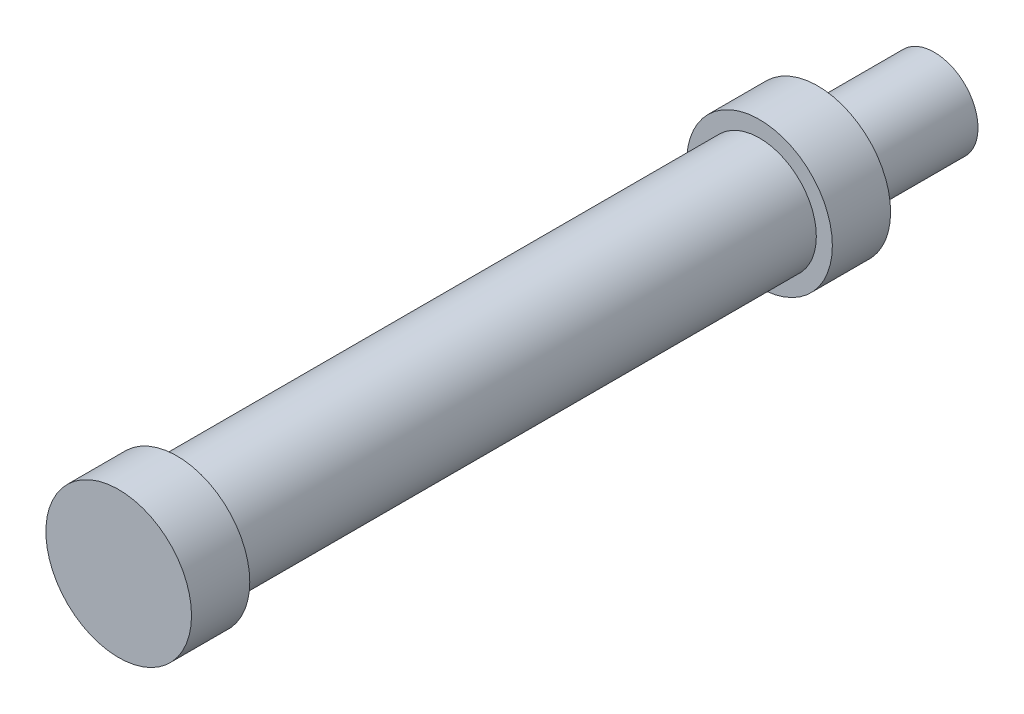
from build123d import *

# Parameters (mm, degrees)
SKETCH1_R           = 1.5
BOSS_EXTRUDE1_DEPTH = 4
SKETCH2_R           = 2.5
BOSS_EXTRUDE2_DEPTH = 2
SKETCH3_R           = 1.95
BOSS_EXTRUDE3_DEPTH = 20
SKETCH4_R           = 2.5
BOSS_EXTRUDE4_DEPTH = 2


with BuildPart() as part:
    # Sketch1 → Boss-Extrude1 (new body)
    with BuildSketch(Plane.XY):
        Circle(SKETCH1_R)
    extrude(amount=BOSS_EXTRUDE1_DEPTH)

    # Sketch2 → Boss-Extrude2 (add)
    with BuildSketch(Plane.XY.offset(4)):
        Circle(SKETCH2_R)
    extrude(amount=BOSS_EXTRUDE2_DEPTH)

    # Sketch3 → Boss-Extrude3 (add)
    with BuildSketch(Plane.XY.offset(6)):
        Circle(SKETCH3_R)
    extrude(amount=BOSS_EXTRUDE3_DEPTH)

    # Sketch4 → Boss-Extrude4 (add)
    with BuildSketch(Plane.XY.offset(26)):
        Circle(SKETCH4_R)
    extrude(amount=BOSS_EXTRUDE4_DEPTH)


solid = part.part
